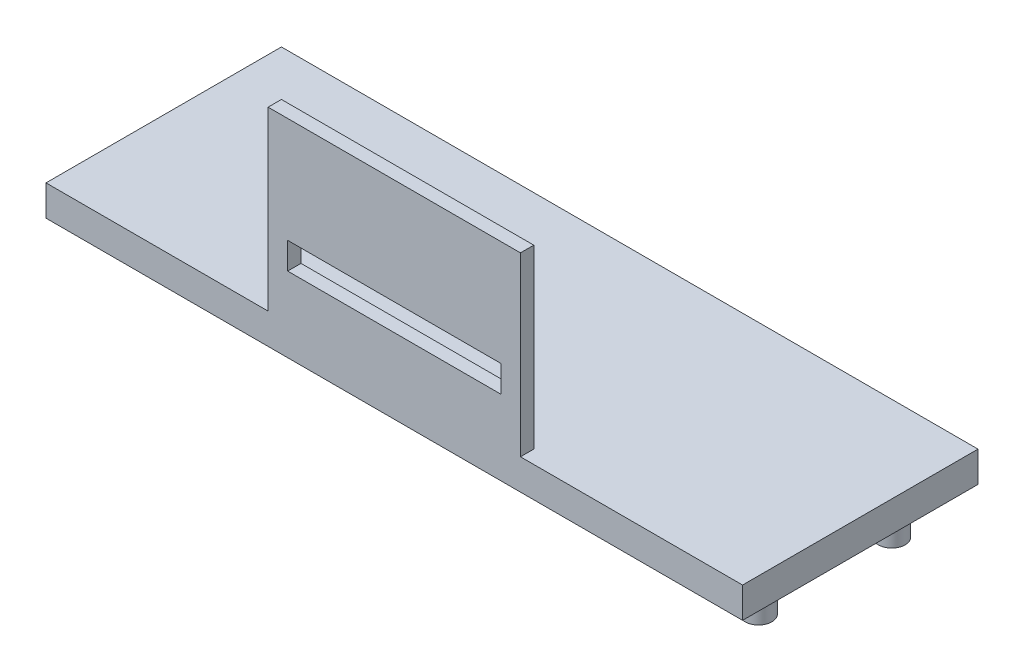
from build123d import *

# Parameters (mm, degrees)
SKETCH1_W           = 56.807908868
SKETCH1_H           = 54.266272082
BOSS_EXTRUDE2_DEPTH = 3
SKETCH2_R           = 4.25
BOSS_EXTRUDE3_DEPTH = 12
SKETCH3_W           = 48
SKETCH3_H           = 6
CUT_EXTRUDE1_DEPTH  = 10
SKETCH4_W           = 56.807908868
SKETCH4_H           = 6.889223191
BOSS_EXTRUDE4_DEPTH = 50
SKETCH5_W           = 53
SKETCH5_H           = 6.889223191
BOSS_EXTRUDE5_DEPTH = 50
SKETCH8_W           = 53
SKETCH8_H           = 6.889223191
BOSS_EXTRUDE6_DEPTH = 50
SKETCH9_W           = 68.867558101
SKETCH9_H           = 60.331860759
CUT_EXTRUDE2_DEPTH  = 26
SKETCH10_W          = 129.878394785
SKETCH10_H          = 53.736094631
CUT_EXTRUDE3_DEPTH  = 22
BOSS_EXTRUDE7_START = -6.889223
SKETCH11_R          = 3
BOSS_EXTRUDE7_DEPTH = 10


with BuildPart() as part:
    # Sketch1 → Boss-Extrude2 (new body)
    with BuildSketch(Plane.XY):
        with Locations((-6.025526457, -12.157362225)):
            Rectangle(SKETCH1_W, SKETCH1_H)
    extrude(amount=-BOSS_EXTRUDE2_DEPTH)

    # Sketch2 → Boss-Extrude3 (add)
    with BuildSketch(Plane.XY):
        with Locations((-26.141196849, 5.26708344)):
            Circle(SKETCH2_R)
        with Locations((-6.541196849, 5.26708344)):
            Circle(SKETCH2_R)
        with Locations((13.058803151, 5.26708344)):
            Circle(SKETCH2_R)
        with Locations((-26.141196849, -29.58291656)):
            Circle(SKETCH2_R)
        with Locations((-6.541196849, -29.58291656)):
            Circle(SKETCH2_R)
        with Locations((13.058803151, -29.58291656)):
            Circle(SKETCH2_R)
    extrude(amount=BOSS_EXTRUDE3_DEPTH)

    # Sketch3 → Cut-Extrude1 (cut)
    with BuildSketch(Plane.XY):
        with Locations((-6.025526457, -11.783671744)):
            Rectangle(SKETCH3_W, SKETCH3_H)
    extrude(amount=-CUT_EXTRUDE1_DEPTH, mode=Mode.SUBTRACT)

    # Sketch4 → Boss-Extrude4 (add)
    with BuildSketch(Plane(origin=(0, 0, -3), x_dir=(-1, 0, 0), z_dir=(0, 0, -1))):
        with Locations((6.025526457, -28.22828334)):
            Rectangle(SKETCH4_W, SKETCH4_H)
    extrude(amount=BOSS_EXTRUDE4_DEPTH)

    # Sketch5 → Boss-Extrude5 (add)
    with BuildSketch(Plane(origin=(22.378427977, 0, 0), x_dir=(0, 0, -1), z_dir=(1, 0, 0))):
        with Locations((26.5, -28.22828334)):
            Rectangle(SKETCH5_W, SKETCH5_H)
    extrude(amount=BOSS_EXTRUDE5_DEPTH)

    # Sketch8 → Boss-Extrude6 (add)
    with BuildSketch(Plane.ZY.offset(34.429480891)):
        with Locations((-26.5, -28.22828334)):
            Rectangle(SKETCH8_W, SKETCH8_H)
    extrude(amount=BOSS_EXTRUDE6_DEPTH)

    # Sketch9 → Cut-Extrude2 (cut)
    with BuildSketch(Plane.XY):
        with Locations((-7.965457672, -13.030331271)):
            Rectangle(SKETCH9_W, SKETCH9_H)
    extrude(amount=CUT_EXTRUDE2_DEPTH, mode=Mode.SUBTRACT)

    # Sketch10 → Cut-Extrude3 (cut)
    with BuildSketch(Plane.XZ.offset(31.672894935)):
        with Locations((-14.803715202, -13.978089422)):
            Rectangle(SKETCH10_W, SKETCH10_H)
    extrude(amount=CUT_EXTRUDE3_DEPTH, mode=Mode.SUBTRACT)

    # Sketch11 → Boss-Extrude7 (add)
    with BuildSketch(Plane(origin=(0, -24.783671744, 0), x_dir=(1, 0, 0), z_dir=(0, 1, 0)).offset(BOSS_EXTRUDE7_START)):
        with Locations(Location((-75.025526457, 43, 0), (0, 0, 270))):
            Circle(SKETCH11_R)
        with Locations(Location((-75.025526457, 13, 0), (0, 0, 270))):
            Circle(SKETCH11_R)
        with Locations(Location((62.974473543, 13, 0), (0, 0, 270))):
            Circle(SKETCH11_R)
        with Locations(Location((62.974473543, 43, 0), (0, 0, 270))):
            Circle(SKETCH11_R)
    extrude(amount=-BOSS_EXTRUDE7_DEPTH)


solid = part.part
